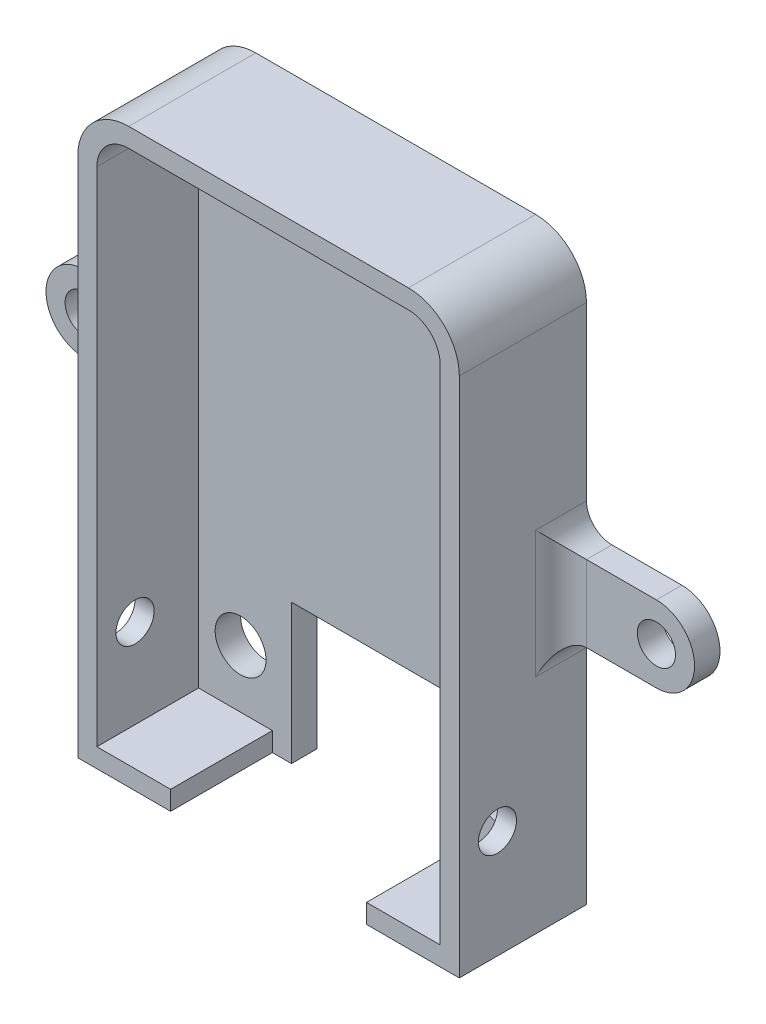
from build123d import *

# Parameters (mm, degrees)
ESQUISSE1_W                  = 30
ESQUISSE1_H                  = 45
BOSS_EXTRU_1_DEPTH           = 2
ESQUISSE3_R                  = 2
ESQUISSE3_W                  = 12.4
ESQUISSE3_H                  = 11
ENL_V_MAT_EXTRU_1_DEPTH      = 28.115494
CONG_1_R                     = 4
BOSS_EXTRU_2_START           = 10
BOSS_EXTRU_2_DEPTH           = 10
ENL_V_MAT_EXTRU_2_DEPTH      = 29.831406
ENL_V_MAT_EXTRU_2_DEPTH_BACK = 29.831406
ESQUISSE7_R                  = 1.5
ESQUISSE10_R                 = 1.5
BOSS_EXTRU_3_DEPTH           = 2
CONG_2_R                     = 2
CONG_3_R                     = 2


with BuildPart() as part:
    # Esquisse1 → Boss.-Extru.1 (new body)
    with BuildSketch(Plane.XY):
        Rectangle(ESQUISSE1_W, ESQUISSE1_H)
    extrude(amount=BOSS_EXTRU_1_DEPTH)

    # Esquisse3 → Enlèv. mat.-Extru.1 (cut, through all)
    with BuildSketch(Plane.XY):
        with Locations((10.2, 16.45)):
            Circle(ESQUISSE3_R)
        with Locations(Location((-10.2, 16.45, 0), (0, 0, 180))):
            Circle(ESQUISSE3_R)
        with Locations((-10.2, -16.45)):
            Circle(ESQUISSE3_R)
        with Locations(Location((10.2, -16.45, 0), (0, 0, 180))):
            Circle(ESQUISSE3_R)
        with Locations((0, -17)):
            Rectangle(ESQUISSE3_W, ESQUISSE3_H)
    extrude(amount=ENL_V_MAT_EXTRU_1_DEPTH, mode=Mode.SUBTRACT)

    # Congé1
    cong_1_edges = [part.edges().sort_by_distance(p)[0] for p in [
        (-15, 22.5, 1),
        (15, 22.5, 1),
    ]]
    fillet(cong_1_edges, radius=CONG_1_R)

    # Esquisse6 → Boss.-Extru.2 (add)
    with BuildSketch(Plane.XY.offset(BOSS_EXTRU_2_START)):
        with BuildLine():
            Line((7.7, -21), (7.7, -22.5))
            Line((7.7, -22.5), (15, -22.5))
            Line((15, -22.5), (15, 18.5))
            ThreePointArc((15, 18.5), (13.828427, 21.328427), (11, 22.5))
            Line((11, 22.5), (-11, 22.5))
            ThreePointArc((-11, 22.5), (-13.828427, 21.328427), (-15, 18.5))
            Line((-15, 18.5), (-15, -22.5))
            Line((-15, -22.5), (-7.7, -22.5))
            Line((-7.7, -22.5), (-7.7, -21))
            Line((-7.7, -21), (-13.5, -21))
            Line((-13.5, -21), (-13.5, 18.5))
            ThreePointArc((-13.5, 18.5), (-12.767767, 20.267767), (-11, 21))
            Line((-11, 21), (11, 21))
            ThreePointArc((11, 21), (12.767767, 20.267767), (13.5, 18.5))
            Line((13.5, 18.5), (13.5, -21))
            Line((13.5, -21), (7.7, -21))
        make_face()
    extrude(amount=-BOSS_EXTRU_2_DEPTH)

    # Esquisse7 → Enlèv. mat.-Extru.2 (cut, two sides: drawn at the far end of the back side and taken through both)
    with BuildSketch(Plane(origin=(0, 0, 0), x_dir=(0, 0, -1), z_dir=(1, 0, 0)).offset(-ENL_V_MAT_EXTRU_2_DEPTH_BACK)):
        with Locations((-7, -14)):
            Circle(ESQUISSE7_R)
    extrude(amount=ENL_V_MAT_EXTRU_2_DEPTH + ENL_V_MAT_EXTRU_2_DEPTH_BACK, mode=Mode.SUBTRACT)

    # Esquisse10 → Boss.-Extru.3 (add)
    with BuildSketch(Plane.XY):
        with BuildLine():
            Line((15, 3), (22.5, 3))
            ThreePointArc((22.5, 3), (25.5, 0), (22.5, -3))
            Line((22.5, -3), (15, -3))
            Line((15, -3), (15, 3))
        make_face()
        with Locations((22.5, 0)):
            Circle(ESQUISSE10_R, mode=Mode.SUBTRACT)
    boss_extru_3 = extrude(amount=BOSS_EXTRU_3_DEPTH)

    # Congé2
    cong_2_edges = [part.edges().sort_by_distance(p)[0] for p in [
        (15, 0, 2),
        (15, 3, 1),
        (15, -3, 1),
    ]]
    fillet(cong_2_edges, radius=CONG_2_R)

    # Symétrie2: Boss.-Extru.3 across plane
    add(boss_extru_3.mirror(Plane(origin=(0, 0, 0), x_dir=(0, 0, 1), z_dir=(1, 0, 0))))

    # Congé3
    cong_3_edges = [part.edges().sort_by_distance(p)[0] for p in [
        (-15, 0, 2),
        (-15, -3, 1),
        (-15, 3, 1),
    ]]
    fillet(cong_3_edges, radius=CONG_3_R)


solid = part.part
